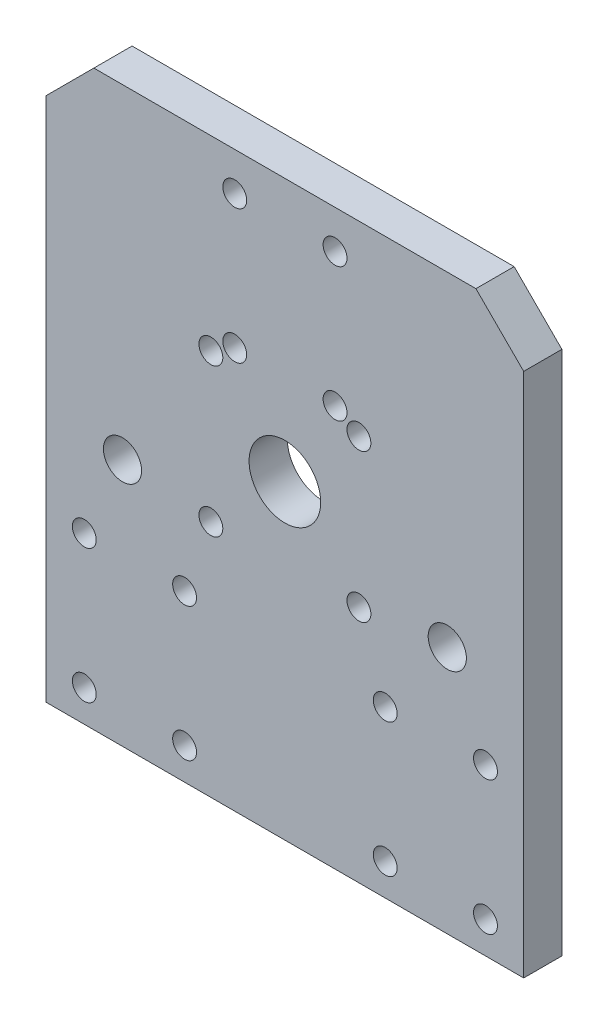
from build123d import *

# Parameters (mm, degrees)
SKETCH1_W           = 100
SKETCH1_H           = 120
SKETCH1_R           = 2.5
SKETCH1_R_2         = 7.5
BOSS_EXTRUDE1_DEPTH = 4
CHAMFER1_SIZE       = 10
SKETCH2_R           = 2.5
SKETCH2_R_2         = 4
CUT_EXTRUDE1_DEPTH  = 131.245921241


with BuildPart() as part:
    # Sketch1 → Boss-Extrude1 (new, symmetric)
    with BuildSketch(Plane.XY):
        with Locations((0, 60)):
            Rectangle(SKETCH1_W, SKETCH1_H)
        with Locations((-42, 6.66986634)):
            Circle(SKETCH1_R, mode=Mode.SUBTRACT)
        with Locations((-21, 6.66986634)):
            Circle(SKETCH1_R, mode=Mode.SUBTRACT)
        with Locations((-42, 34.66986634)):
            Circle(SKETCH1_R, mode=Mode.SUBTRACT)
        with Locations((-21, 34.66986634)):
            Circle(SKETCH1_R, mode=Mode.SUBTRACT)
        with Locations((-10.5, 112)):
            Circle(SKETCH1_R, mode=Mode.SUBTRACT)
        with Locations((-10.5, 84)):
            Circle(SKETCH1_R, mode=Mode.SUBTRACT)
        with Locations((10.5, 84)):
            Circle(SKETCH1_R, mode=Mode.SUBTRACT)
        with Locations((10.5, 112)):
            Circle(SKETCH1_R, mode=Mode.SUBTRACT)
        with Locations((21, 34.66986634)):
            Circle(SKETCH1_R, mode=Mode.SUBTRACT)
        with Locations((42, 34.66986634)):
            Circle(SKETCH1_R, mode=Mode.SUBTRACT)
        with Locations((21, 6.66986634)):
            Circle(SKETCH1_R, mode=Mode.SUBTRACT)
        with Locations((42, 6.66986634)):
            Circle(SKETCH1_R, mode=Mode.SUBTRACT)
        with Locations((0, 65)):
            Circle(SKETCH1_R_2, mode=Mode.SUBTRACT)
    extrude(amount=BOSS_EXTRUDE1_DEPTH, both=True)

    # Chamfer1
    chamfer1_edges = [part.edges().sort_by_distance(p)[0] for p in [
        (50, 120, 0),
        (-50, 120, 0),
    ]]
    chamfer(chamfer1_edges, length=CHAMFER1_SIZE)

    # Sketch2 → Cut-Extrude1 (cut, through all)
    with BuildSketch(Plane.XY.offset(4)):
        with Locations((-15.5, 80.98)):
            Circle(SKETCH2_R)
        with Locations((-15.5, 49.98)):
            Circle(SKETCH2_R)
        with Locations((15.5, 80.98)):
            Circle(SKETCH2_R)
        with Locations((15.5, 49.98)):
            Circle(SKETCH2_R)
        with Locations((-34, 51.98)):
            Circle(SKETCH2_R_2)
        with Locations((34, 51.98)):
            Circle(SKETCH2_R_2)
    extrude(amount=-CUT_EXTRUDE1_DEPTH, mode=Mode.SUBTRACT)


solid = part.part
